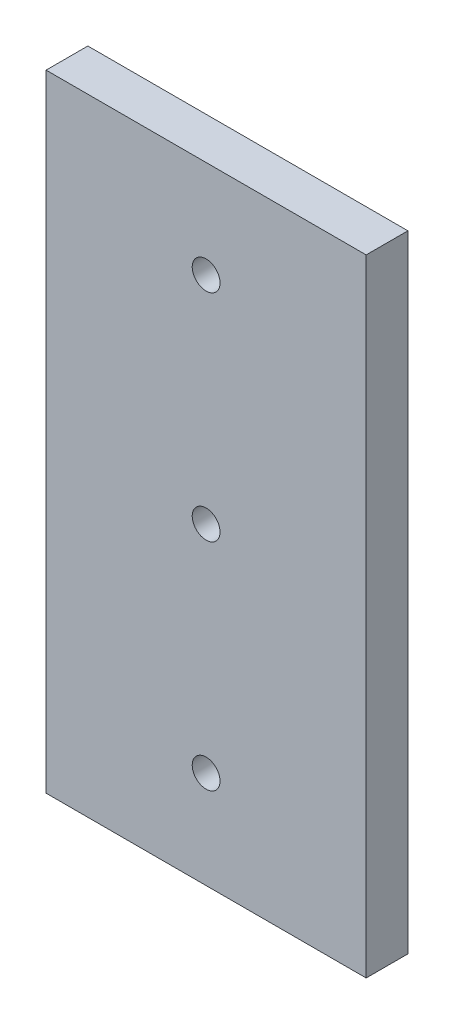
from build123d import *

# Parameters (mm, degrees)
ESBO_O1_W                = 115
ESBO_O1_H                = 225
RESSALTO_EXTRUS_O1_DEPTH = 15
ESBO_O2_R                = 5
CORTE_EXTRUS_O1_DEPTH    = 254.130401177


with BuildPart() as part:
    # Esboço1 → Ressalto-extrusão1 (new body)
    with BuildSketch(Plane.XY):
        with Locations((57.5, 112.5)):
            Rectangle(ESBO_O1_W, ESBO_O1_H)
    extrude(amount=RESSALTO_EXTRUS_O1_DEPTH)

    # Esboço2 → Corte-extrusão1 (cut, through all)
    with BuildSketch(Plane.XY.offset(15)):
        with Locations((57.5, 190)):
            Circle(ESBO_O2_R)
        with Locations((57.5, 112.5)):
            Circle(ESBO_O2_R)
        with Locations(Location((57.5, 35, 0), (0, 0, 180))):
            Circle(ESBO_O2_R)
    extrude(amount=-CORTE_EXTRUS_O1_DEPTH, mode=Mode.SUBTRACT)


solid = part.part
